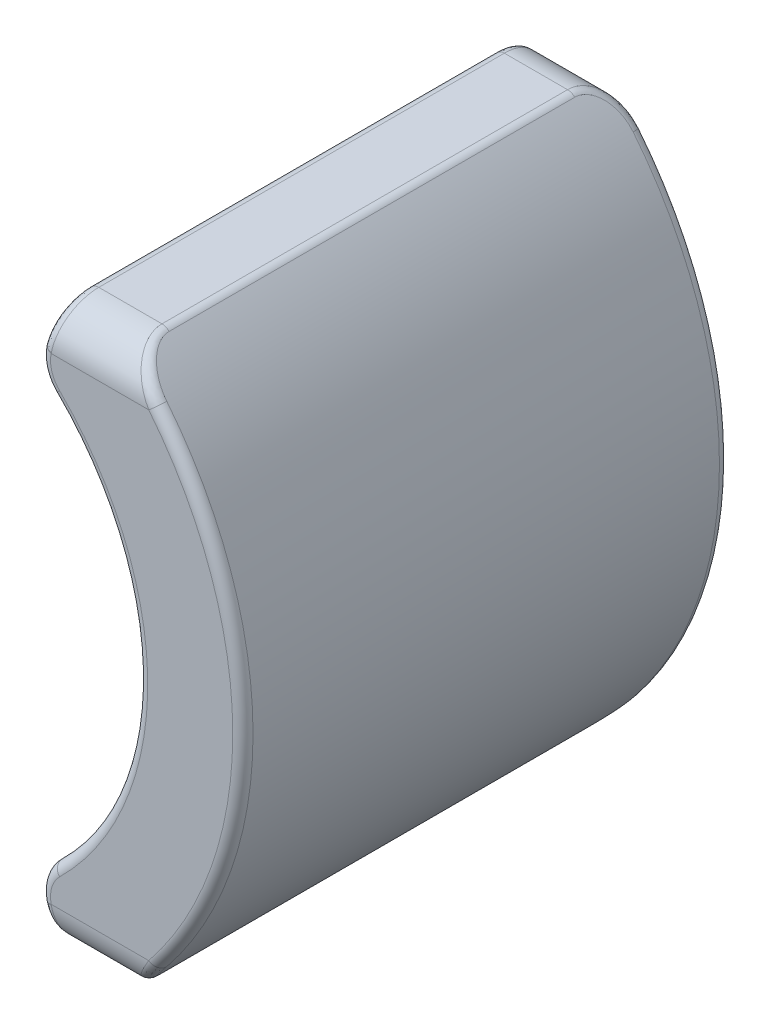
from build123d import *

# Parameters (mm, degrees)
BOSS_EXTRUDE1_DEPTH = 12
FILLET1_R           = 1
FILLET2_R           = 1
FILLET3_R           = 0.25


with BuildPart() as part:
    # Sketch1 → Boss-Extrude1 (new body)
    with BuildSketch(Plane.XY):
        with BuildLine():
            Line((-2.891862275, -6.88), (-4.751862275, -6.88))
            Line((-4.751862275, -6.88), (-5.098164562, -5.38))
            ThreePointArc((-5.098164562, -5.38), (-2.595660483, 0), (-5.098164562, 5.38))
            Line((-5.098164562, 5.38), (-4.751862275, 6.88))
            Line((-4.751862275, 6.88), (-2.891862275, 6.88))
            ThreePointArc((-2.891862275, 6.88), (0, 0), (-2.891862275, -6.88))
        make_face()
    extrude(amount=BOSS_EXTRUDE1_DEPTH)

    # Fillet1
    fillet1_edges = [part.edges().sort_by_distance(p)[0] for p in [
        (-5.098164562, -5.38, 6),
        (-5.098164562, 5.38, 6),
    ]]
    fillet(fillet1_edges, radius=FILLET1_R)

    # Fillet2
    fillet2_edges = [part.edges().sort_by_distance(p)[0] for p in [
        (-3.821862275, 6.88, 0),
        (-3.821862275, -6.88, 0),
        (-3.821862275, -6.88, 12),
        (-3.821862275, 6.88, 12),
    ]]
    fillet(fillet2_edges, radius=FILLET2_R)

    # Fillet3
    fillet3_edges = [part.edges().sort_by_distance(p)[0] for p in [
        (-2.595660483, 0, 0),
        (-2.595660483, 0, 12),
        (-4.942122734, 5.411310183, 0),
        (-4.942122734, -5.411310183, 12),
        (-4.751862275, 6.88, 6),
        (-2.891862275, 6.88, 6),
        (-4.814876511, 6.607055355, 11.686578845),
        (-4.814876511, 6.607055355, 0.313421155),
        (-4.942122734, 5.411310183, 12),
        (-4.974065224, 5.914769544, 11.99939535),
        (-4.974065224, 5.914769544, 0.00060465),
        (0, 0, 0),
        (-4.942122734, -5.411310183, 0),
        (0, 0, 12),
        (-2.891862275, -6.88, 6),
        (-2.565663423, 6.544619807, 11.7471817),
        (-2.565663411, -6.544619821, 11.747181705),
        (-2.565663423, -6.544619807, 0.2528183),
        (-2.565663423, 6.544619807, 0.2528183),
        (-4.751862275, -6.88, 6),
        (-4.974065228, -5.914769545, 11.999395357),
        (-4.974065228, -5.914769545, 0.000604643),
        (-4.814876511, -6.607055355, 11.686578845),
        (-4.814876511, -6.607055355, 0.313421155),
    ]]
    fillet(fillet3_edges, radius=FILLET3_R)


solid = part.part
